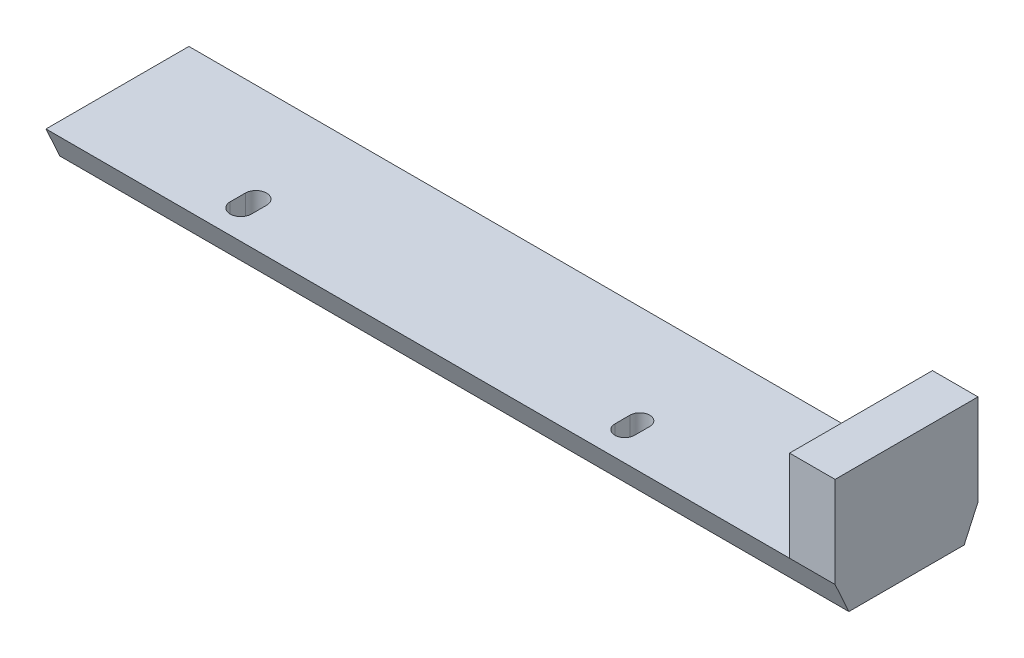
from build123d import *

# Parameters (mm, degrees)
SKETCH_1_W               = 52
SKETCH_1_H               = 10
EXTRUDE_1_DEPTH          = 2
SKETCH_5_R               = 0.6
CUT_EXTRUDE_1_DEPTH      = 53.990565198
SKETCH_6_W               = 3
SKETCH_6_H               = 10
EXTRUDE_2_DEPTH          = 6
CUT_EXTRUDE_2_DEPTH      = 54.291650378
CUT_EXTRUDE_3_DEPTH      = 54.553711356
CUT_EXTRUDE_3_DEPTH_BACK = 54.553711356
SKETCH_10_W              = 55.109364361
SKETCH_10_H              = 11.207374239
CUT_EXTRUDE_4_DEPTH      = 54.500153703


with BuildPart() as part:
    # 草图1 → 凸台-拉伸1 (new body)
    with BuildSketch(Plane(origin=(0, 0, 0), x_dir=(1, 0, 0), z_dir=(0, 1, 0))):
        with Locations((26, -5)):
            Rectangle(SKETCH_1_W, SKETCH_1_H)
    extrude(amount=EXTRUDE_1_DEPTH)

    # 草图5 → 切除-拉伸1 (cut, through all)
    with BuildSketch(Plane(origin=(0, 2, 0), x_dir=(1, 0, 0), z_dir=(0, 1, 0))):
        with Locations(Location((36.226363192, -2.7, 0), (0, 0, 270))):
            Circle(SKETCH_5_R)
        with Locations(Location((10.926363192, -2.7, 0), (0, 0, 270))):
            Circle(SKETCH_5_R)
    extrude(amount=-CUT_EXTRUDE_1_DEPTH, mode=Mode.SUBTRACT)

    # 草图6 → 凸台-拉伸2 (add)
    with BuildSketch(Plane(origin=(0, 2, 0), x_dir=(1, 0, 0), z_dir=(0, 1, 0))):
        with Locations((50.5, -5)):
            Rectangle(SKETCH_6_W, SKETCH_6_H)
    extrude(amount=EXTRUDE_2_DEPTH)

    # 草图7 → 切除-拉伸2 (cut, through all)
    with BuildSketch(Plane(origin=(0, 2, 0), x_dir=(1, 0, 0), z_dir=(0, 1, 0))):
        with BuildLine():
            Line((11.626363192, -2.2), (11.626363192, -3.2))
            ThreePointArc((11.626363192, -3.2), (10.926363192, -3.9), (10.226363192, -3.2))
            Line((10.226363192, -3.2), (10.226363192, -2.2))
            ThreePointArc((10.226363192, -2.2), (10.926363192, -1.5), (11.626363192, -2.2))
        make_face()
        with BuildLine():
            Line((36.876363192, -2.2), (36.876363192, -3.2))
            ThreePointArc((36.876363192, -3.2), (36.226363192, -3.85), (35.576363192, -3.2))
            Line((35.576363192, -3.2), (35.576363192, -2.2))
            ThreePointArc((35.576363192, -2.2), (36.226363192, -1.55), (36.876363192, -2.2))
        make_face()
    extrude(amount=-CUT_EXTRUDE_2_DEPTH, mode=Mode.SUBTRACT)

    # 草图9 → 切除-拉伸3 (cut, two sides: drawn at the far end of the back side and taken through both)
    with BuildSketch(Plane(origin=(52, 0, 0), x_dir=(0, 0, -1), z_dir=(1, 0, 0)).offset(-CUT_EXTRUDE_3_DEPTH_BACK)):
        Polygon((-0.290909091, 2), (-1.2, 0), (0, 0), (0, 8), (-0.290909091, 8), align=None)
        Polygon((-9.709090909, 2), (-8.8, 0), (-10, 0), (-10, 8), (-9.709090909, 8), align=None)
    extrude(amount=CUT_EXTRUDE_3_DEPTH + CUT_EXTRUDE_3_DEPTH_BACK, mode=Mode.SUBTRACT)


with BuildPart() as body_2:
    # 镜向1: mirrored copy
    add(part.part.mirror(Plane.XY))


with BuildPart() as part_1:
    add(part.part)

    # 草图10 → 切除-拉伸4 (cut, through all)
    with BuildSketch(Plane.XY):
        with Locations((25.033847049, 2.789088301)):
            Rectangle(SKETCH_10_W, SKETCH_10_H)
    extrude(amount=CUT_EXTRUDE_4_DEPTH, mode=Mode.SUBTRACT)


solid = body_2.part
